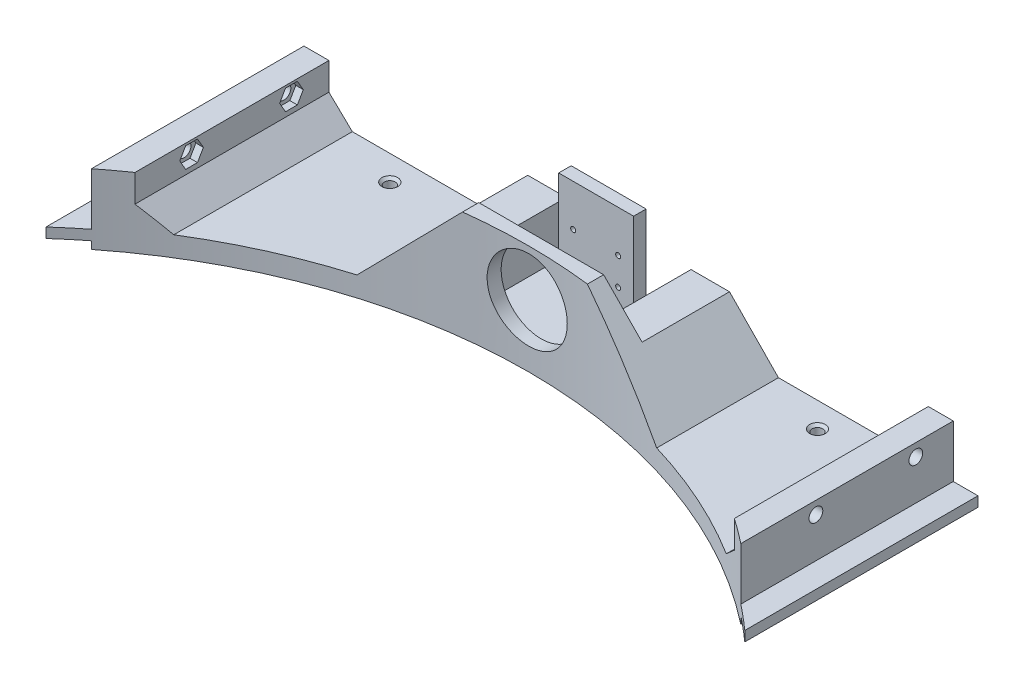
from build123d import *

# Parameters (mm, degrees)
SKETCH1_W               = 650
SKETCH1_H               = 650
BOSS_EXTRUDE1_DEPTH     = 8
BOSS_EXTRUDE2_DEPTH     = 650
CUT_EXTRUDE2_DEPTH      = 921.277302922
CUT_EXTRUDE2_DEPTH_BACK = 921.277302922
SKETCH4_R               = 16.05
CUT_EXTRUDE1_DEPTH      = 920.932062709
CUT_EXTRUDE1_DEPTH_BACK = 920.932062709
SKETCH2_R               = 210
CUT_EXTRUDE3_DEPTH      = 921.277302998
CUT_EXTRUDE3_DEPTH_BACK = 110
CUT_EXTRUDE4_DEPTH      = 110
CUT_EXTRUDE5_DEPTH      = 920.932062713
CUT_EXTRUDE5_DEPTH_BACK = 920.932062713
SKETCH7_OUTSIDE_W       = 836.056
SKETCH7_OUTSIDE_H       = 836.056
SKETCH7_OUTSIDE_W_2     = 260
SKETCH7_OUTSIDE_H_2     = 231.544504505
BOSS_EXTRUDE3_DEPTH     = 170
SKETCH9_W               = 9.9
SKETCH9_H               = 4
BOSS_EXTRUDE4_DEPTH     = 170
CUT_EXTRUDE6_DEPTH      = 800.941879143
CUT_EXTRUDE6_DEPTH_BACK = 800.941879143
SKETCH10_R              = 210
SKETCH11_W              = 30
SKETCH11_H              = 5
BOSS_EXTRUDE5_DEPTH     = 40
CUT_EXTRUDE7_DEPTH      = 801.144993169
CUT_EXTRUDE7_DEPTH_BACK = 801.144993169
SKETCH13_R              = 2.75
CUT_EXTRUDE8_DEPTH      = 10
SKETCH14_R              = 2.75
CUT_EXTRUDE9_DEPTH      = 10
CUT_EXTRUDE10_DEPTH     = 3
LPATTERN1_COUNT         = 2
LPATTERN1_PITCH         = 40
CUT_EXTRUDE11_DEPTH     = 3
LPATTERN2_COUNT         = 2
LPATTERN2_PITCH         = 40
SKETCH17_R              = 2.15
CUT_EXTRUDE12_DEPTH     = 10
CHAMFER1_SIZE           = 1
SKETCH18_W              = 60.1
SKETCH18_H              = 15.1
CUT_EXTRUDE13_DEPTH     = 3
SKETCH19_R              = 1
CUT_EXTRUDE14_DEPTH     = 10


with BuildPart() as part:
    # Sketch1 → Boss-Extrude1 (new body)
    with BuildSketch(Plane(origin=(0, 0, 0), x_dir=(1, 0, 0), z_dir=(0, 1, 0))):
        with Locations((325, 325)):
            Rectangle(SKETCH1_W, SKETCH1_H)
    extrude(amount=BOSS_EXTRUDE1_DEPTH)

    # Sketch3 → Boss-Extrude2 (add)
    with BuildSketch(Plane.XY):
        Polygon((300, 43.707142143), (350, 43.707142143), (385, 8), (265, 8), align=None)
    extrude(amount=-BOSS_EXTRUDE2_DEPTH)

    # Sketch4 → Cut-Extrude2 (cut, two sides: drawn at the far end of the back side and taken through both)
    with BuildSketch(Plane.XY.offset(-CUT_EXTRUDE2_DEPTH_BACK)):
        with Locations((325, 25)):
            Circle(SKETCH4_R)
    extrude(amount=CUT_EXTRUDE2_DEPTH + CUT_EXTRUDE2_DEPTH_BACK, mode=Mode.SUBTRACT)

    # Sketch2 → Cut-Extrude1 (cut, two sides: drawn at the far end of the back side and taken through both)
    with BuildSketch(Plane(origin=(0, 8, 0), x_dir=(1, 0, 0), z_dir=(0, 1, 0)).offset(-CUT_EXTRUDE1_DEPTH_BACK)):
        with Locations(Location((325, 325, 0), (0, 0, 270))):
            Circle(SKETCH2_R)
    extrude(amount=CUT_EXTRUDE1_DEPTH + CUT_EXTRUDE1_DEPTH_BACK, mode=Mode.SUBTRACT)

    # Sketch5 → Cut-Extrude3 (cut, two sides: drawn at the far end of the back side and taken through both)
    with BuildSketch(Plane.XY.offset(-CUT_EXTRUDE3_DEPTH_BACK)):
        Polygon((300, 43.707142143), (350, 43.707142143), (365.396078824, 28), (350, 28), (350, 8), (300, 8), (300, 28), (284.603921176, 28), align=None)
    extrude(amount=CUT_EXTRUDE3_DEPTH + CUT_EXTRUDE3_DEPTH_BACK, mode=Mode.SUBTRACT)

    # Sketch6 → Cut-Extrude4 (cut)
    with BuildSketch(Plane(origin=(0, 0, -650), x_dir=(-1, 0, 0), z_dir=(0, 0, -1))):
        Polygon((-350, 43.707142143), (-300, 43.707142143), (-284.603921176, 28), (-300, 28), (-300, 8), (-350, 8), (-350, 28), (-365.396078824, 28), align=None)
    extrude(amount=-CUT_EXTRUDE4_DEPTH, mode=Mode.SUBTRACT)

    # Sketch7 outside → Cut-Extrude5 (cut, two sides: drawn at the far end of the back side and taken through both)
    with BuildSketch(Plane(origin=(0, 8, 0), x_dir=(1, 0, 0), z_dir=(0, 1, 0)).offset(-CUT_EXTRUDE5_DEPTH_BACK)):
        with Locations((325, 325)):
            Rectangle(SKETCH7_OUTSIDE_W, SKETCH7_OUTSIDE_H)
        with Locations((325, 570.772252253)):
            Rectangle(SKETCH7_OUTSIDE_W_2, SKETCH7_OUTSIDE_H_2, mode=Mode.SUBTRACT)
    extrude(amount=CUT_EXTRUDE5_DEPTH + CUT_EXTRUDE5_DEPTH_BACK, mode=Mode.SUBTRACT)

    # Sketch8 → Boss-Extrude3 (add)
    with BuildSketch(Plane(origin=(0, 0, -650), x_dir=(-1, 0, 0), z_dir=(0, 0, -1))):
        Polygon((-455, 8), (-455, 28), (-445, 28), (-445, 17), (-435.61916848, 8), align=None)
        Polygon((-195, 8), (-195, 28), (-205, 28), (-205, 17), (-214.38083152, 8), align=None)
    extrude(amount=-BOSS_EXTRUDE3_DEPTH)

    # Sketch9 → Boss-Extrude4 (add)
    with BuildSketch(Plane(origin=(0, 0, -650), x_dir=(-1, 0, 0), z_dir=(0, 0, -1))):
        with Locations((-459.95, 5)):
            Rectangle(SKETCH9_W, SKETCH9_H)
        with Locations((-190.05, 5)):
            Rectangle(SKETCH9_W, SKETCH9_H)
    extrude(amount=-BOSS_EXTRUDE4_DEPTH)

    # Sketch10 → Cut-Extrude6 (cut, two sides: drawn at the far end of the back side and taken through both)
    with BuildSketch(Plane(origin=(0, 8, 0), x_dir=(1, 0, 0), z_dir=(0, 1, 0)).offset(-CUT_EXTRUDE6_DEPTH_BACK)):
        with Locations((325, 325)):
            Circle(SKETCH10_R)
    extrude(amount=CUT_EXTRUDE6_DEPTH + CUT_EXTRUDE6_DEPTH_BACK, mode=Mode.SUBTRACT)

    # Sketch11 → Boss-Extrude5 (add)
    with BuildSketch(Plane(origin=(0, 8, 0), x_dir=(1, 0, 0), z_dir=(0, 1, 0))):
        with Locations((325, 564.5)):
            Rectangle(SKETCH11_W, SKETCH11_H)
    extrude(amount=BOSS_EXTRUDE5_DEPTH)

    # Sketch12 → Cut-Extrude7 (cut, two sides: drawn at the far end of the back side and taken through both)
    with BuildSketch(Plane(origin=(0, 8, 0), x_dir=(1, 0, 0), z_dir=(0, 1, 0)).offset(-CUT_EXTRUDE7_DEPTH_BACK)):
        Polygon((325, 650), (468.244620066, 650), (468.244620066, 575), (178.69132389, 575), (178.69132389, 650), align=None)
    extrude(amount=CUT_EXTRUDE7_DEPTH + CUT_EXTRUDE7_DEPTH_BACK, mode=Mode.SUBTRACT)

    # Sketch13 → Cut-Extrude8 (cut)
    with BuildSketch(Plane(origin=(205, 0, 0), x_dir=(0, 0, -1), z_dir=(1, 0, 0))):
        with Locations((520, 23)):
            Circle(SKETCH13_R)
        with Locations((560, 23)):
            Circle(SKETCH13_R)
    extrude(amount=-CUT_EXTRUDE8_DEPTH, mode=Mode.SUBTRACT)

    # Sketch14 → Cut-Extrude9 (cut)
    with BuildSketch(Plane(origin=(455, 0, 0), x_dir=(0, 0, -1), z_dir=(1, 0, 0))):
        with Locations((560, 23)):
            Circle(SKETCH14_R)
        with Locations((520, 23)):
            Circle(SKETCH14_R)
    extrude(amount=-CUT_EXTRUDE9_DEPTH, mode=Mode.SUBTRACT)

    # Sketch15 → Cut-Extrude10 (cut)
    with BuildSketch(Plane(origin=(205, 0, 0), x_dir=(0, 0, -1), z_dir=(1, 0, 0))):
        Polygon((557.632863896, 27.1), (562.367136104, 27.1), (564.734272207, 23), (562.367136104, 18.9), (557.632863896, 18.9), (555.265727793, 23), align=None)
    cut_extrude10 = extrude(amount=-CUT_EXTRUDE10_DEPTH, mode=Mode.SUBTRACT)

    # LPattern1: Cut-Extrude10 ×2
    with Locations(*[(0, 0, i * LPATTERN1_PITCH) for i in range(1, LPATTERN1_COUNT)]):
        add(cut_extrude10, mode=Mode.SUBTRACT)

    # Sketch16 → Cut-Extrude11 (cut)
    with BuildSketch(Plane.ZY.offset(-445)):
        Polygon((-522.367136104, 27.1), (-517.632863896, 27.1), (-515.265727793, 23), (-517.632863896, 18.9), (-522.367136104, 18.9), (-524.734272207, 23), align=None)
    cut_extrude11 = extrude(amount=-CUT_EXTRUDE11_DEPTH, mode=Mode.SUBTRACT)

    # LPattern2: Cut-Extrude11 ×2
    with Locations(*[(0, 0, -i * LPATTERN2_PITCH) for i in range(1, LPATTERN2_COUNT)]):
        add(cut_extrude11, mode=Mode.SUBTRACT)

    # Sketch17 → Cut-Extrude12 (cut)
    with BuildSketch(Plane(origin=(0, 8, 0), x_dir=(1, 0, 0), z_dir=(0, 1, 0))):
        with Locations(Location((239.38083152, 565, 0), (0, 0, 270))):
            Circle(SKETCH17_R)
        with Locations(Location((410.61916848, 565, 0), (0, 0, 270))):
            Circle(SKETCH17_R)
    extrude(amount=-CUT_EXTRUDE12_DEPTH, mode=Mode.SUBTRACT)

    # Chamfer1
    chamfer1_edges = [part.edges().sort_by_distance(p)[0] for p in [
        (239.38083152, 0, -567.15),
        (239.38083152, 8, -567.15),
        (410.61916848, 8, -567.15),
    ]]
    chamfer(chamfer1_edges, length=CHAMFER1_SIZE)

    # Sketch18 → Cut-Extrude13 (cut)
    with BuildSketch(Plane(origin=(0, 0, 0), x_dir=(-1, 0, 0), z_dir=(0, -1, 0))):
        with Locations((-324.95, 554.45)):
            Rectangle(SKETCH18_W, SKETCH18_H)
    extrude(amount=-CUT_EXTRUDE13_DEPTH, mode=Mode.SUBTRACT)

    # Sketch19 → Cut-Extrude14 (cut)
    with BuildSketch(Plane.XY.offset(-562)):
        with Locations((315.81, 20.26)):
            Circle(SKETCH19_R)
        with Locations((333.81, 20.26)):
            Circle(SKETCH19_R)
        with Locations((333.81, 31.26)):
            Circle(SKETCH19_R)
        with Locations((315.81, 31.26)):
            Circle(SKETCH19_R)
    extrude(amount=-CUT_EXTRUDE14_DEPTH, mode=Mode.SUBTRACT)


solid = part.part
